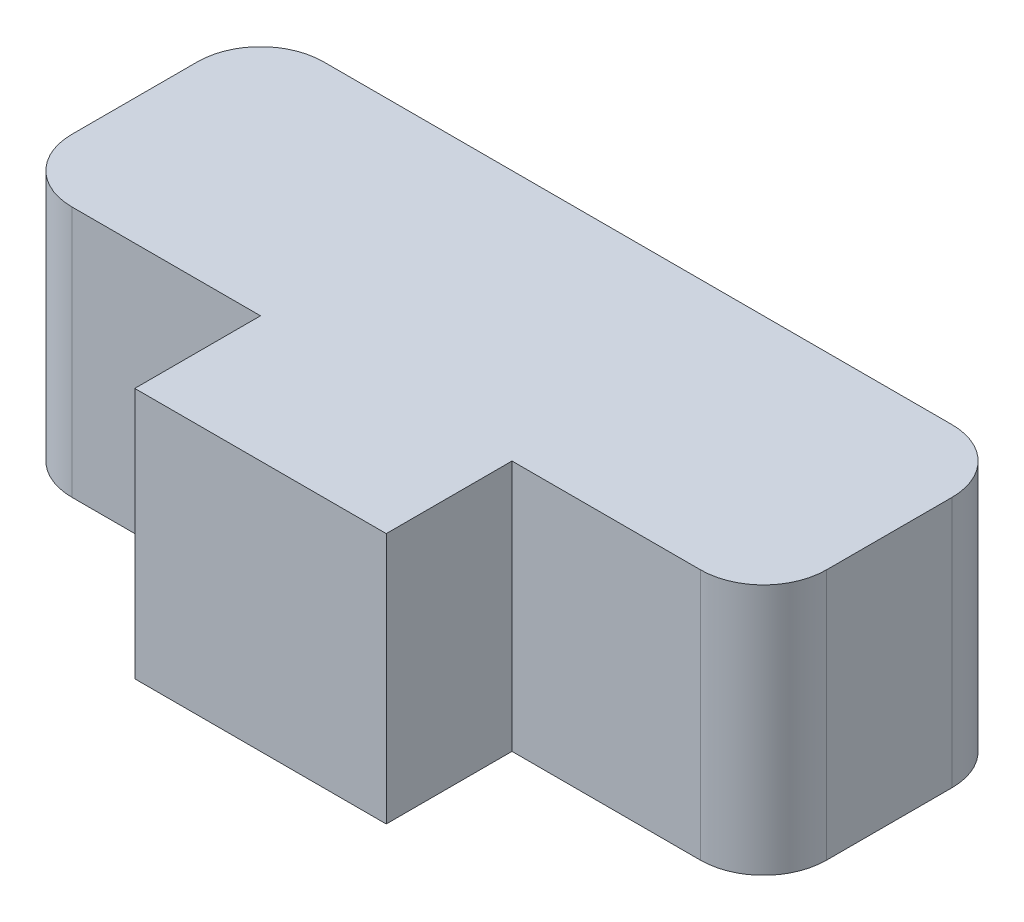
from build123d import *

# Parameters (mm, degrees)
BOSS_EXTRUDE1_DEPTH = 5.08
FILLET1_R           = 1.27


with BuildPart() as part:
    # Sketch1 → Boss-Extrude1 (new body)
    with BuildSketch(Plane(origin=(0, 0, 0), x_dir=(1, 0, 0), z_dir=(0, 1, 0))):
        Polygon((5.08, 0), (10.16, 0), (10.16, 5.08), (-5.08, 5.08), (-5.08, 0), (0, 0), (0, -2.54), (5.08, -2.54), align=None)
    extrude(amount=BOSS_EXTRUDE1_DEPTH)

    # Fillet1
    fillet1_edges = [part.edges().sort_by_distance(p)[0] for p in [
        (-5.08, 2.54, 0),
        (-5.08, 2.54, -5.08),
        (10.16, 2.54, -5.08),
        (10.16, 2.54, 0),
    ]]
    fillet(fillet1_edges, radius=FILLET1_R)


solid = part.part
